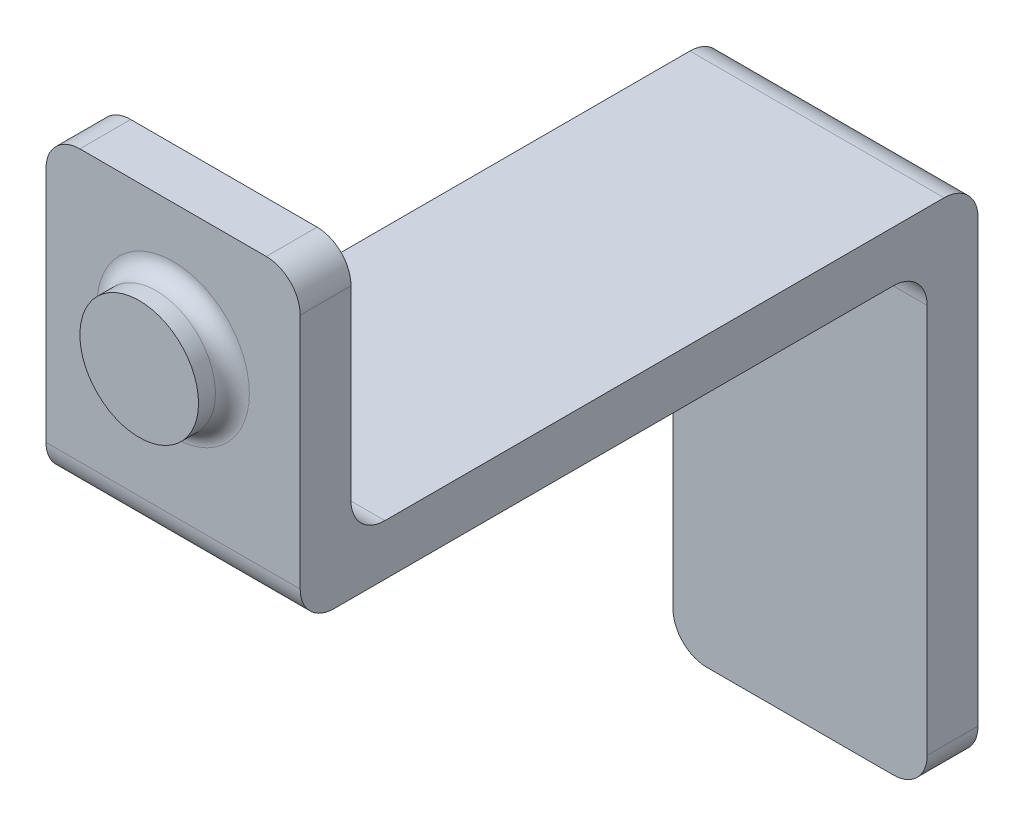
from build123d import *

# Parameters (mm, degrees)
EXTRUDE_1_DEPTH      = 7.5
EXTRUDE_1_DEPTH_BACK = 7.5
FILLET_1_R           = 2
SKETCH_2_R           = 3.5
EXTRUDE_3_DEPTH      = 2
SKETCH_4_R           = 2.025
CUT_EXTRUDE_1_DEPTH  = 4
FILLET_2_R           = 1


with BuildPart() as part:
    # 草圖1 → 填料-伸長1 (new, two sides: drawn at the far end of the back side and taken through both)
    with BuildSketch(Plane(origin=(0, 0, 0), x_dir=(0, 0, -1), z_dir=(1, 0, 0)).offset(-EXTRUDE_1_DEPTH_BACK)):
        Polygon((-34, 18), (-34, 3), (3, 3), (3, -27), (0, -27), (0, 0), (-37, 0), (-37, 18), align=None)
    extrude(amount=EXTRUDE_1_DEPTH + EXTRUDE_1_DEPTH_BACK)

    # 圓角1
    fillet_1_edges = [part.edges().sort_by_distance(p)[0] for p in [
        (-7.5, -27, -1.5),
        (7.5, -27, -1.5),
        (-7.5, 18, 35.5),
        (7.5, 18, 35.5),
        (0, 3, -3),
        (0, 3, 34),
        (0, 0, 37),
        (0, 0, 0),
    ]]
    fillet(fillet_1_edges, radius=FILLET_1_R)

    # 草圖2 → 填料-伸長3 (add)
    with BuildSketch(Plane.XY.offset(37)):
        with Locations((0, 10.5)):
            Circle(SKETCH_2_R)
    extrude(amount=EXTRUDE_3_DEPTH)

    # 草圖4 → 除料-伸長1 (cut)
    with BuildSketch(Plane(origin=(0, 0, 34), x_dir=(-1, 0, 0), z_dir=(0, 0, -1))):
        with Locations((0, 10.5)):
            Circle(SKETCH_4_R)
    extrude(amount=-CUT_EXTRUDE_1_DEPTH, mode=Mode.SUBTRACT)

    # 圓角2
    fillet_2_edges = [part.edges().sort_by_distance(p)[0] for p in [
        (-3.5, 10.5, 37),
    ]]
    fillet(fillet_2_edges, radius=FILLET_2_R)


solid = part.part
